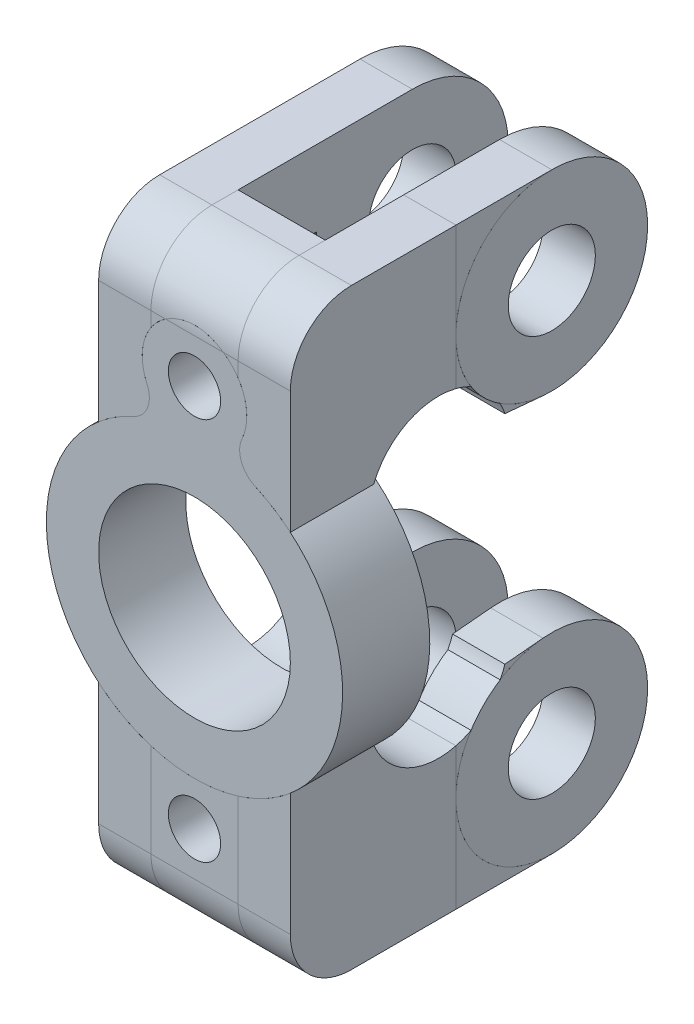
from build123d import *

# Parameters (mm, degrees)
SKETCH_1_R          = 5.5
SKETCH_1_R_2        = 1.5
EXTRUDE_1_DEPTH     = 5
EXTRUDE_START       = -2.5
SKETCH_2_R          = 5.5
SKETCH_2_R_2        = 2.5
EXTRUDE_2_DEPTH     = 3
EXTRUDE_2_2_DEPTH   = 3
EXTRUDE_START_2     = 2.5
SKETCH_3_R          = 5.5
SKETCH_3_R_2        = 2.5
EXTRUDE_3_DEPTH     = 3
EXTRUDE_3_2_DEPTH   = 3
EXTRUDE_4_DEPTH     = 9.5
EXTRUDE_4_2_DEPTH   = 9.5
EXTRUDE_4_3_DEPTH   = 9.5
EXTRUDE_4_4_DEPTH   = 9.5
EXTRUDE_5_DEPTH     = 3
EXTRUDE_6_DEPTH     = 3
EXTRUDE_6_2_DEPTH   = 3
EXTRUDE_6_3_DEPTH   = 3
EXTRUDE_6_4_DEPTH   = 3
EXTRUDE_7_DEPTH     = 5
EXTRUDE_7_2_DEPTH   = 5
SKETCH_8_R          = 4
CUT_EXTRUDE_1_DEPTH = 27.930466019
SKETCH_9_R          = 1.5
CUT_EXTRUDE_2_DEPTH = 5
CUT_EXTRUDE_3_DEPTH = 27.930466019


with BuildPart() as part:
    # Эскиз1 → Бобышка-Вытянуть1 (new body)
    with BuildSketch(Plane.XY):
        with BuildLine():
            ThreePointArc((-3.477151956, 7.756250013), (-2.2e-08, -8.5), (3.477151997, 7.756249995))
            ThreePointArc((3.477151997, 7.756249995), (2.686810587, 8.596884227), (2.727178017, 9.749999975))
            ThreePointArc((2.727178017, 9.749999975), (2.2e-08, 14), (-2.727178036, 9.750000015))
            ThreePointArc((-2.727178036, 9.750000015), (-2.686810571, 8.596884269), (-3.477151956, 7.756250013))
        make_face()
        Circle(SKETCH_1_R, mode=Mode.SUBTRACT)
        with Locations((0, 11)):
            Circle(SKETCH_1_R_2, mode=Mode.SUBTRACT)
    extrude(amount=EXTRUDE_1_DEPTH)


with BuildPart() as body_2:
    # Эскиз2 → Бобышка-Вытянуть2 (new body)
    with BuildSketch(Plane(origin=(0, 0, 0), x_dir=(0, 0, -1), z_dir=(1, 0, 0)).offset(EXTRUDE_START)):
        with Locations((10, 11.5)):
            Circle(SKETCH_2_R)
        with Locations((10, 11.5)):
            Circle(SKETCH_2_R_2, mode=Mode.SUBTRACT)
    extrude(amount=-EXTRUDE_2_DEPTH)



with BuildPart() as body_3:
    # Эскиз2 → Extrude 2 2 (new body)
    with BuildSketch(Plane(origin=(0, 0, 0), x_dir=(0, 0, -1), z_dir=(1, 0, 0)).offset(EXTRUDE_START)):
        with Locations((10, -11.5)):
            Circle(SKETCH_2_R)
        with Locations((10, -11.5)):
            Circle(SKETCH_2_R_2, mode=Mode.SUBTRACT)
    extrude(amount=-EXTRUDE_2_2_DEPTH)


with BuildPart() as body_4:
    # Эскиз3 → Бобышка-Вытянуть3 (new body)
    with BuildSketch(Plane(origin=(0, 0, 0), x_dir=(0, 0, -1), z_dir=(1, 0, 0)).offset(EXTRUDE_START_2)):
        with Locations((10, 11.5)):
            Circle(SKETCH_3_R)
        with Locations((10, 11.5)):
            Circle(SKETCH_3_R_2, mode=Mode.SUBTRACT)
    extrude(amount=EXTRUDE_3_DEPTH)


with BuildPart() as body_5:
    # Эскиз3 → Extrude 3 2 (new body)
    with BuildSketch(Plane(origin=(0, 0, 0), x_dir=(0, 0, -1), z_dir=(1, 0, 0)).offset(EXTRUDE_START_2)):
        with Locations((10, -11.5)):
            Circle(SKETCH_3_R)
        with Locations((10, -11.5)):
            Circle(SKETCH_3_R_2, mode=Mode.SUBTRACT)
    extrude(amount=EXTRUDE_3_2_DEPTH)


with BuildPart() as body_6:
    # Эскиз4 → Бобышка-Вытянуть4 (new body)
    with BuildSketch(Plane.XY.offset(5)):
        with BuildLine():
            ThreePointArc((-2.5, -8.124038405), (-4.083516479, -7.454857018), (-5.5, -6.480740698))
            Line((-5.5, -6.480740698), (-5.5, -17))
            Line((-5.5, -17), (-2.5, -17))
            Line((-2.5, -17), (-2.5, -8.124038405))
        make_face()
    extrude(amount=-EXTRUDE_4_DEPTH)


with BuildPart() as body_7:
    # Эскиз4 → Extrude 4 2 (new body)
    with BuildSketch(Plane.XY.offset(5)):
        with BuildLine():
            ThreePointArc((5.5, -6.480740698), (4.083516479, -7.454857018), (2.5, -8.124038405))
            Line((2.5, -8.124038405), (2.5, -17))
            Line((2.5, -17), (5.5, -17))
            Line((5.5, -17), (5.5, -6.480740698))
        make_face()
    extrude(amount=-EXTRUDE_4_2_DEPTH)


with BuildPart() as body_8:
    # Эскиз4 → Extrude 4 3 (new body)
    with BuildSketch(Plane.XY.offset(5)):
        with BuildLine():
            Line((2.5, 17), (2.5, 12.658312395))
            ThreePointArc((2.5, 12.658312395), (2.872281323, 11.866025404), (3, 11))
            ThreePointArc((3, 11), (2.931001031, 10.360286817), (2.727178029, 9.75))
            ThreePointArc((2.727178029, 9.75), (2.68681058, 8.596884246), (3.477151987, 7.75625))
            ThreePointArc((3.477151987, 7.75625), (4.533656961, 7.189989886), (5.5, 6.480740698))
            Line((5.5, 6.480740698), (5.5, 17))
            Line((5.5, 17), (2.5, 17))
        make_face()
    extrude(amount=-EXTRUDE_4_3_DEPTH)


with BuildPart() as body_9:
    # Эскиз4 → Extrude 4 4 (new body)
    with BuildSketch(Plane.XY.offset(5)):
        with BuildLine():
            Line((-5.5, 17), (-5.5, 6.480740698))
            ThreePointArc((-5.5, 6.480740698), (-4.533656961, 7.189989886), (-3.477151987, 7.75625))
            ThreePointArc((-3.477151987, 7.75625), (-2.68681058, 8.596884246), (-2.727178029, 9.75))
            ThreePointArc((-2.727178029, 9.75), (-2.990889129, 11.233628374), (-2.5, 12.658312395))
            Line((-2.5, 12.658312395), (-2.5, 17))
            Line((-2.5, 17), (-5.5, 17))
        make_face()
    extrude(amount=-EXTRUDE_4_4_DEPTH)


with BuildPart() as body_2_1:
    add(body_2.part)

    add(body_3.part)  # Бобышка-Вытянуть5 merges body 3

    add(body_6.part)  # Бобышка-Вытянуть5 merges body 6

    add(body_9.part)  # Бобышка-Вытянуть5 merges body 9
    # Эскиз5 → Бобышка-Вытянуть5 (add)
    with BuildSketch(Plane.ZY.offset(5.5)):
        with BuildLine():
            Line((-4.5, -6.480740698), (-9.498336734, -6.022926514))
            ThreePointArc((-9.498336734, -6.022926514), (-5.937417819, -7.792517563), (-4.5, -11.5))
            Line((-4.5, -11.5), (-4.5, -6.480740698))
        make_face()
        with BuildLine():
            Line((-4.5, -17), (-4.5, -11.5))
            ThreePointArc((-4.5, -11.5), (-6.110912703, -15.389087297), (-10, -17))
            Line((-10, -17), (-4.5, -17))
        make_face()
        with BuildLine():
            Line((-4.5, 6.480740698), (-4.5, 11.5))
            ThreePointArc((-4.5, 11.5), (-5.937417819, 7.792517563), (-9.498336734, 6.022926514))
            Line((-9.498336734, 6.022926514), (-4.5, 6.480740698))
        make_face()
        with BuildLine():
            Line((-4.5, 17), (-10, 17))
            ThreePointArc((-10, 17), (-6.110912703, 15.389087297), (-4.5, 11.5))
            Line((-4.5, 11.5), (-4.5, 17))
        make_face()
    extrude(amount=-EXTRUDE_5_DEPTH)


with BuildPart() as body_7_2:
    # Эскиз6 → Бобышка-Вытянуть6 (new body)
    with BuildSketch(Plane(origin=(5.5, 0, 0), x_dir=(0, 0, -1), z_dir=(1, 0, 0))):
        with BuildLine():
            Line((4.5, -6.480740698), (4.5, -11.5))
            ThreePointArc((4.5, -11.5), (5.937417819, -7.792517563), (9.498336734, -6.022926514))
            Line((9.498336734, -6.022926514), (4.5, -6.480740698))
        make_face()
    extrude(amount=-EXTRUDE_6_DEPTH)


with BuildPart() as body_8_2:
    # Эскиз6 → Extrude 6 2 (new body)
    with BuildSketch(Plane(origin=(5.5, 0, 0), x_dir=(0, 0, -1), z_dir=(1, 0, 0))):
        with BuildLine():
            Line((4.5, -17), (10, -17))
            ThreePointArc((10, -17), (6.110912703, -15.389087297), (4.5, -11.5))
            Line((4.5, -11.5), (4.5, -17))
        make_face()
    extrude(amount=-EXTRUDE_6_2_DEPTH)


with BuildPart() as body_9_2:
    # Эскиз6 → Extrude 6 3 (new body)
    with BuildSketch(Plane(origin=(5.5, 0, 0), x_dir=(0, 0, -1), z_dir=(1, 0, 0))):
        with BuildLine():
            ThreePointArc((4.5, 11.499999994), (6.110912701, 15.389087294), (10, 17))
            Line((10, 17), (4.5, 17))
            Line((4.5, 17), (4.5, 11.499999994))
        make_face()
    extrude(amount=-EXTRUDE_6_3_DEPTH)


with BuildPart() as body_10:
    # Эскиз6 → Extrude 6 4 (new body)
    with BuildSketch(Plane(origin=(5.5, 0, 0), x_dir=(0, 0, -1), z_dir=(1, 0, 0))):
        with BuildLine():
            ThreePointArc((9.498336734, 6.022926514), (5.937417821, 7.792517561), (4.5, 11.499999994))
            Line((4.5, 11.499999994), (4.5, 6.480740698))
            Line((4.5, 6.480740698), (9.498336734, 6.022926514))
        make_face()
    extrude(amount=-EXTRUDE_6_4_DEPTH)


with BuildPart() as body_11:
    # Эскиз7 → Бобышка-Вытянуть7 (new body)
    with BuildSketch(Plane.XY.offset(5)):
        with BuildLine():
            Line((-2.5, 17), (-2.5, 12.658312395))
            ThreePointArc((-2.5, 12.658312395), (0, 14), (2.5, 12.658312395))
            Line((2.5, 12.658312395), (2.5, 17))
            Line((2.5, 17), (-2.5, 17))
        make_face()
    extrude(amount=-EXTRUDE_7_DEPTH)


with BuildPart() as body_12:
    # Эскиз7 → Extrude 7 2 (new body)
    with BuildSketch(Plane.XY.offset(5)):
        with BuildLine():
            ThreePointArc((2.5, -8.124038405), (0, -8.5), (-2.5, -8.124038405))
            Line((-2.5, -8.124038405), (-2.5, -17))
            Line((-2.5, -17), (2.5, -17))
            Line((2.5, -17), (2.5, -8.124038405))
        make_face()
    extrude(amount=-EXTRUDE_7_2_DEPTH)

    # Эскиз9 → Вырез-Вытянуть2 (cut)
    with BuildSketch(Plane.XY.offset(5)):
        with Locations((0, -11)):
            Circle(SKETCH_9_R)
    extrude(amount=-CUT_EXTRUDE_2_DEPTH, mode=Mode.SUBTRACT)


with BuildPart() as cut_extrude_1_tool:
    # Эскиз8 → Вырез-Вытянуть1 (new, through all)
    with BuildSketch(Plane(origin=(5.5, 0, 0), x_dir=(0, 0, -1), z_dir=(1, 0, 0))):
        with Locations((3.5, 5)):
            Circle(SKETCH_8_R)
        with Locations((3.5, -5)):
            Circle(SKETCH_8_R)
    extrude(amount=-CUT_EXTRUDE_1_DEPTH)


with BuildPart() as body_2_2:
    add(body_2_1.part)

    # Вырез-Вытянуть1: cut by cut_extrude_1_tool
    add(cut_extrude_1_tool.part, mode=Mode.SUBTRACT)


with BuildPart() as body_7_1:
    add(body_7.part)

    # Вырез-Вытянуть1: cut by cut_extrude_1_tool
    add(cut_extrude_1_tool.part, mode=Mode.SUBTRACT)


with BuildPart() as body_8_1:
    add(body_8.part)

    # Вырез-Вытянуть1: cut by cut_extrude_1_tool
    add(cut_extrude_1_tool.part, mode=Mode.SUBTRACT)


with BuildPart() as body_7_2_1:
    add(body_7_2.part)

    # Вырез-Вытянуть1: cut by cut_extrude_1_tool
    add(cut_extrude_1_tool.part, mode=Mode.SUBTRACT)


with BuildPart() as body_10_1:
    add(body_10.part)

    # Вырез-Вытянуть1: cut by cut_extrude_1_tool
    add(cut_extrude_1_tool.part, mode=Mode.SUBTRACT)


with BuildPart() as cut_extrude_3_tool:
    # Эскиз10 → Вырез-Вытянуть3 (new, through all)
    with BuildSketch(Plane(origin=(5.5, 0, 0), x_dir=(0, 0, -1), z_dir=(1, 0, 0))):
        with BuildLine():
            ThreePointArc((-1.5, -17), (-3.974873734, -15.974873734), (-5, -13.5))
            Line((-5, -13.5), (-5, -17))
            Line((-5, -17), (-1.5, -17))
        make_face()
        with BuildLine():
            ThreePointArc((-5, 13.5), (-3.974873734, 15.974873734), (-1.5, 17))
            Line((-1.5, 17), (-5, 17))
            Line((-5, 17), (-5, 13.5))
        make_face()
    extrude(amount=-CUT_EXTRUDE_3_DEPTH)


with BuildPart() as part_1:
    add(part.part)

    # Вырез-Вытянуть3: cut by cut_extrude_3_tool
    add(cut_extrude_3_tool.part, mode=Mode.SUBTRACT)


with BuildPart() as body_2_3:
    add(body_2_2.part)

    # Вырез-Вытянуть3: cut by cut_extrude_3_tool
    add(cut_extrude_3_tool.part, mode=Mode.SUBTRACT)


with BuildPart() as body_7_3:
    add(body_7_1.part)

    # Вырез-Вытянуть3: cut by cut_extrude_3_tool
    add(cut_extrude_3_tool.part, mode=Mode.SUBTRACT)


with BuildPart() as body_8_3:
    add(body_8_1.part)

    # Вырез-Вытянуть3: cut by cut_extrude_3_tool
    add(cut_extrude_3_tool.part, mode=Mode.SUBTRACT)


with BuildPart() as body_11_1:
    add(body_11.part)

    # Вырез-Вытянуть3: cut by cut_extrude_3_tool
    add(cut_extrude_3_tool.part, mode=Mode.SUBTRACT)


with BuildPart() as body_12_1:
    add(body_12.part)

    # Вырез-Вытянуть3: cut by cut_extrude_3_tool
    add(cut_extrude_3_tool.part, mode=Mode.SUBTRACT)


solid = Compound([body_4.part, body_5.part, body_8_2.part, body_9_2.part, body_7_2_1.part, body_10_1.part, part_1.part, body_2_3.part, body_7_3.part, body_8_3.part, body_11_1.part, body_12_1.part])
